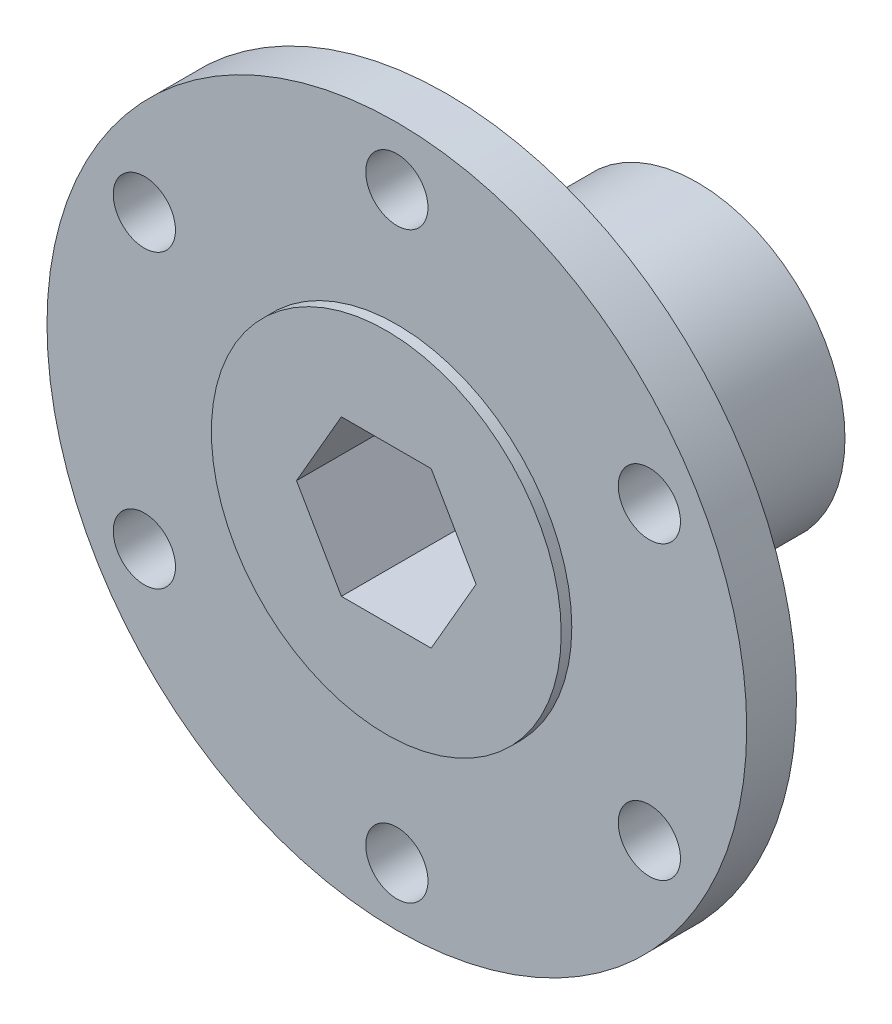
from build123d import *

# Parameters (mm, degrees)
SKETCH1_R           = 28.575
SKETCH1_R_2         = 2.54
BOSS_EXTRUDE1_DEPTH = 4.064
SKETCH2_R           = 14.2875
BOSS_EXTRUDE2_DEPTH = 0.8636
SKETCH3_R           = 12.065
EXTRUDE_M_DEPTH     = 20.4724


with BuildPart() as part:
    # Sketch1 → Boss-Extrude1 (new body)
    with BuildSketch(Plane.XY):
        Circle(SKETCH1_R)
        with Locations((0, 23.8125)):
            Circle(SKETCH1_R_2, mode=Mode.SUBTRACT)
        with Locations((20.622229928, 11.90625)):
            Circle(SKETCH1_R_2, mode=Mode.SUBTRACT)
        with Locations((20.622229928, -11.90625)):
            Circle(SKETCH1_R_2, mode=Mode.SUBTRACT)
        with Locations((0, -23.8125)):
            Circle(SKETCH1_R_2, mode=Mode.SUBTRACT)
        with Locations((-20.622229928, -11.90625)):
            Circle(SKETCH1_R_2, mode=Mode.SUBTRACT)
        with Locations((-20.622229928, 11.90625)):
            Circle(SKETCH1_R_2, mode=Mode.SUBTRACT)
        Polygon((7.332348419, 0), (3.666174209, 6.35), (-3.666174209, 6.35), (-7.332348419, 0), (-3.666174209, -6.35), (3.666174209, -6.35), align=None, mode=Mode.SUBTRACT)
    extrude(amount=BOSS_EXTRUDE1_DEPTH)

    # Sketch2 → Boss-Extrude2 (add)
    with BuildSketch(Plane.XY.offset(4.064)):
        Circle(SKETCH2_R)
        Polygon((-3.666174209, 6.35), (3.666174209, 6.35), (7.332348419, 0), (3.666174209, -6.35), (-3.666174209, -6.35), (-7.332348419, 0), align=None, mode=Mode.SUBTRACT)
    extrude(amount=BOSS_EXTRUDE2_DEPTH)

    # Sketch3 → Extrude m (add)
    with BuildSketch(Plane(origin=(0, 0, 0), x_dir=(-1, 0, 0), z_dir=(0, 0, -1))):
        with Locations(Location((0, 0, 0), (0, 0, 180))):
            Circle(SKETCH3_R)
        Polygon((7.332348419, 0), (3.666174209, 6.35), (-3.666174209, 6.35), (-7.332348419, 0), (-3.666174209, -6.35), (3.666174209, -6.35), align=None, mode=Mode.SUBTRACT)
    extrude(amount=EXTRUDE_M_DEPTH)


solid = part.part
